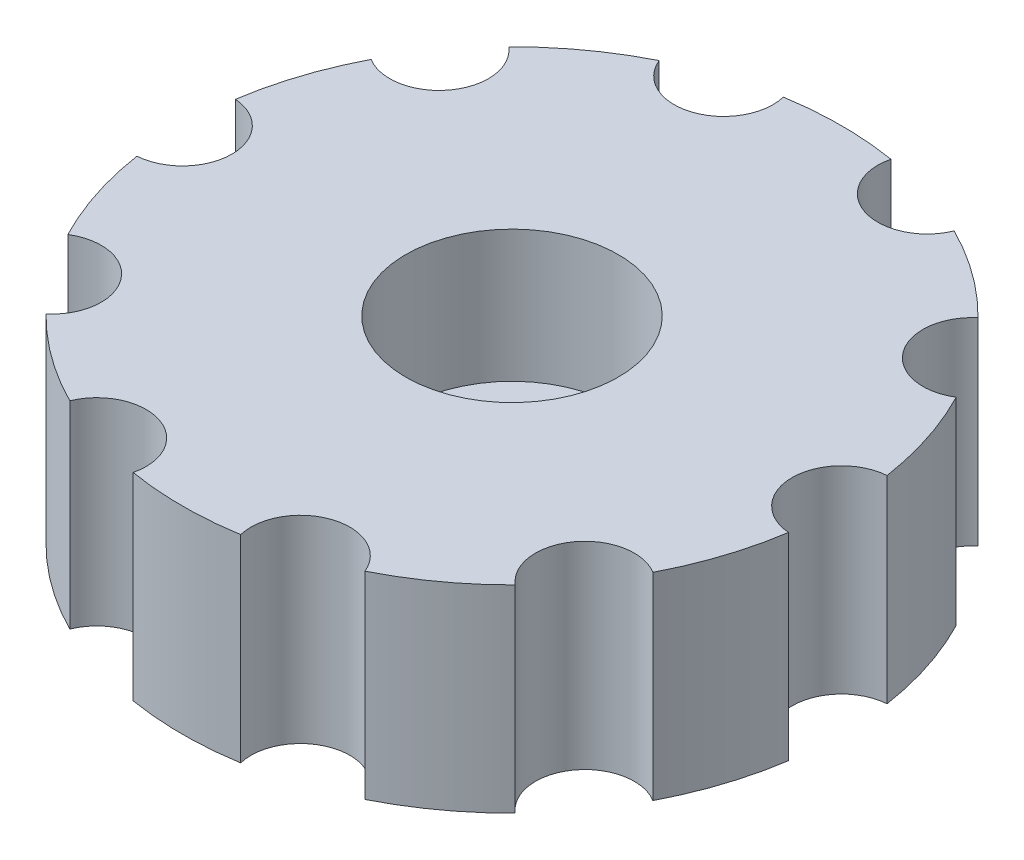
from build123d import *

# Parameters (mm, degrees)
SKETCH1_R           = 20
SKETCH1_R_2         = 3.25
BOSS_EXTRUDE1_DEPTH = 12
SKETCH2_R           = 6.45
CUT_EXTRUDE1_DEPTH  = 8
SKETCH3_R           = 3
CUT_EXTRUDE2_DEPTH  = 31.724582991
CIRPATTERN1_COUNT   = 10


with BuildPart() as part:
    # Sketch1 → Boss-Extrude1 (new body)
    with BuildSketch(Plane(origin=(0, 0, 0), x_dir=(1, 0, 0), z_dir=(0, 1, 0))):
        with Locations(Location((0, 0, 0), (0, 0, 270))):
            Circle(SKETCH1_R)
        with Locations(Location((0, 0, 0), (0, 0, 270))):
            Circle(SKETCH1_R_2, mode=Mode.SUBTRACT)
    extrude(amount=BOSS_EXTRUDE1_DEPTH)

    # Sketch2 → Cut-Extrude1 (cut)
    with BuildSketch(Plane(origin=(0, 12, 0), x_dir=(1, 0, 0), z_dir=(0, 1, 0))):
        with Locations(Location((0, 0, 0), (0, 0, 270))):
            Circle(SKETCH2_R)
    extrude(amount=-CUT_EXTRUDE1_DEPTH, mode=Mode.SUBTRACT)

    # Sketch3 → Cut-Extrude2 (cut, through all)
    with BuildSketch(Plane(origin=(0, 12, 0), x_dir=(1, 0, 0), z_dir=(0, 1, 0))):
        with Locations((20, 0)):
            Circle(SKETCH3_R)
    cut_extrude2 = extrude(amount=-CUT_EXTRUDE2_DEPTH, mode=Mode.SUBTRACT)

    # CirPattern1: Cut-Extrude2 ×10 about axis
    cirpattern1_axis = Axis((0, 0, 0), (0, 1, 0))
    for i in range(1, CIRPATTERN1_COUNT):
        add(cut_extrude2.rotate(cirpattern1_axis, i * 360 / CIRPATTERN1_COUNT), mode=Mode.SUBTRACT)


solid = part.part
